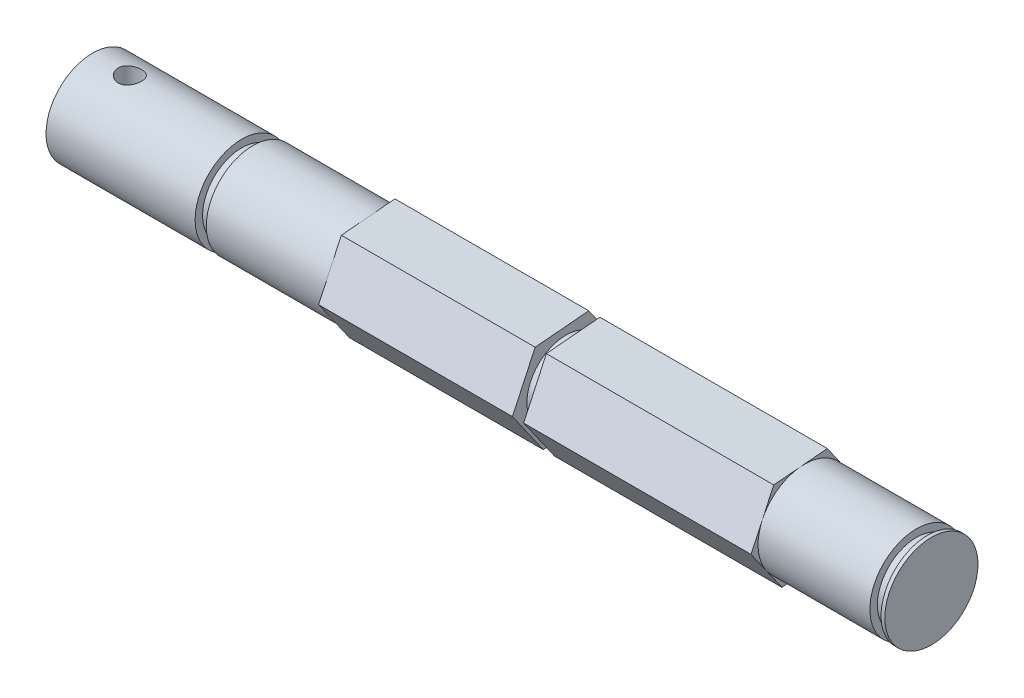
from build123d import *

# Parameters (mm, degrees)
BOSS_EXTRUDE1_DEPTH     = 38.1
SKETCH3_R               = 3.175
BOSS_EXTRUDE3_DEPTH     = 19.05
CUT_EXTRUDE1_DEPTH      = 39.418677326
CUT_EXTRUDE1_DEPTH_BACK = 39.418677326
SKETCH4_R               = 0.79375
CUT_EXTRUDE4_DEPTH      = 8.636
SKETCH6_OUTSIDE_W       = 20.904
SKETCH6_OUTSIDE_H       = 20.248
SKETCH6_OUTSIDE_R       = 2.667
CUT_EXTRUDE5_DEPTH      = 0.762
SKETCH9_OUTSIDE_W       = 20.904
SKETCH9_OUTSIDE_H       = 20.248
SKETCH9_OUTSIDE_R       = 2.667
CUT_EXTRUDE6_DEPTH      = 0.762
SKETCH10_OUTSIDE_W      = 20.904
SKETCH10_OUTSIDE_H      = 20.248
SKETCH10_OUTSIDE_R      = 2.667
CUT_EXTRUDE7_DEPTH      = 0.762


with BuildPart() as part:
    # Sketch1 → Boss-Extrude1 (new body)
    with BuildSketch(Plane(origin=(0, 0, 0), x_dir=(0, 0, -1), z_dir=(1, 0, 0))):
        Polygon((2.105028301, -3.00161443), (3.651988499, 0.32220077), (1.546960198, 3.323815199), (-2.105028301, 3.00161443), (-3.651988499, -0.32220077), (-1.546960198, -3.323815199), align=None)
    extrude(amount=BOSS_EXTRUDE1_DEPTH)

    # Sketch3 → Boss-Extrude3 (add)
    with BuildSketch(Plane.ZY):
        with Locations(Location((0, 0, 0), (0, 0, 204.958070598))):
            Circle(SKETCH3_R)
    extrude(amount=BOSS_EXTRUDE3_DEPTH)

    # Sketch4 → Cut-Extrude1 (cut, two sides: drawn at the far end of the back side and taken through both)
    with BuildSketch(Plane(origin=(0, 0, 0), x_dir=(1, 0, 0), z_dir=(0, 1, 0)).offset(-CUT_EXTRUDE1_DEPTH_BACK)):
        with Locations(Location((-16.51, 0, 0), (0, 0, 90))):
            Circle(SKETCH4_R)
    extrude(amount=CUT_EXTRUDE1_DEPTH + CUT_EXTRUDE1_DEPTH_BACK, mode=Mode.SUBTRACT)

    # Sketch5 → Cut-Extrude4 (cut)
    with BuildSketch(Plane(origin=(38.1, 0, 0), x_dir=(0, 0, -1), z_dir=(1, 0, 0))):
        with BuildLine():
            Line((-2.878508392, 1.339706848), (-2.105028301, 3.00161443))
            ThreePointArc((-2.105028301, 3.00161443), (-3.323815199, 1.546960198), (-3.651988499, -0.32220077))
            Line((-3.651988499, -0.32220077), (-2.878508392, 1.339706848))
        make_face()
        with BuildLine():
            Line((-2.878508392, 1.339706848), (-3.651988499, -0.32220077))
            Line((-3.651988499, -0.32220077), (-2.599474334, -1.823008005))
            ThreePointArc((-2.599474334, -1.823008005), (-3.162714814, -0.279034054), (-2.878508392, 1.339706848))
        make_face()
        with BuildLine():
            ThreePointArc((-3.651988499, -0.32220077), (-3.00161443, -2.105028301), (-1.546960198, -3.323815199))
            Line((-1.546960198, -3.323815199), (-2.599474334, -1.823008005))
            Line((-2.599474334, -1.823008005), (-3.651988499, -0.32220077))
        make_face()
        with BuildLine():
            Line((-2.599474334, -1.823008005), (-1.546960198, -3.323815199))
            Line((-1.546960198, -3.323815199), (0.279034067, -3.162714813))
            ThreePointArc((0.279034067, -3.162714813), (-1.339706811, -2.878508409), (-2.599474334, -1.823008005))
        make_face()
        with BuildLine():
            ThreePointArc((-1.546960198, -3.323815199), (0.32220077, -3.651988499), (2.105028301, -3.00161443))
            Line((2.105028301, -3.00161443), (0.279034067, -3.162714813))
            Line((0.279034067, -3.162714813), (-1.546960198, -3.323815199))
        make_face()
        with BuildLine():
            Line((0.279034067, -3.162714813), (2.105028301, -3.00161443))
            Line((2.105028301, -3.00161443), (2.878508392, -1.339706848))
            ThreePointArc((2.878508392, -1.339706848), (1.823007983, -2.59947435), (0.279034067, -3.162714813))
        make_face()
        with BuildLine():
            ThreePointArc((2.105028301, -3.00161443), (3.252555442, -1.69166085), (3.666174209, 0))
            ThreePointArc((3.666174209, 0), (3.662626065, 0.16125645), (3.651988499, 0.32220077))
            Line((3.651988499, 0.32220077), (2.878508392, -1.339706848))
            Line((2.878508392, -1.339706848), (2.105028301, -3.00161443))
        make_face()
        with BuildLine():
            Line((2.878508392, -1.339706848), (3.651988499, 0.32220077))
            Line((3.651988499, 0.32220077), (2.599474407, 1.823007901))
            ThreePointArc((2.599474407, 1.823007901), (3.027701789, 0.955848774), (3.175, 0))
            ThreePointArc((3.175, 0), (3.09999106, -0.686061534), (2.878508392, -1.339706848))
        make_face()
        with BuildLine():
            Line((2.599474407, 1.823007901), (3.651988499, 0.32220077))
            ThreePointArc((3.651988499, 0.32220077), (3.00161443, 2.105028301), (1.546960198, 3.323815199))
            Line((1.546960198, 3.323815199), (2.599474407, 1.823007901))
        make_face()
        with BuildLine():
            Line((2.599474407, 1.823007901), (1.546960198, 3.323815199))
            Line((1.546960198, 3.323815199), (-0.279034067, 3.162714813))
            ThreePointArc((-0.279034067, 3.162714813), (1.339706869, 2.878508382), (2.599474407, 1.823007901))
        make_face()
        with BuildLine():
            Line((-0.279034067, 3.162714813), (1.546960198, 3.323815199))
            ThreePointArc((1.546960198, 3.323815199), (-0.32220077, 3.651988499), (-2.105028301, 3.00161443))
            Line((-2.105028301, 3.00161443), (-0.279034067, 3.162714813))
        make_face()
        with BuildLine():
            Line((-0.279034067, 3.162714813), (-2.105028301, 3.00161443))
            Line((-2.105028301, 3.00161443), (-2.878508392, 1.339706848))
            ThreePointArc((-2.878508392, 1.339706848), (-1.823007983, 2.59947435), (-0.279034067, 3.162714813))
        make_face()
    extrude(amount=-CUT_EXTRUDE4_DEPTH, mode=Mode.SUBTRACT)

    # Sketch6 outside → Cut-Extrude5 (cut)
    with BuildSketch(Plane(origin=(37.084, 0, 0), x_dir=(0, 0, -1), z_dir=(1, 0, 0))):
        Rectangle(SKETCH6_OUTSIDE_W, SKETCH6_OUTSIDE_H)
        with Locations(Location((0, 0, 0), (0, 0, 180))):
            Circle(SKETCH6_OUTSIDE_R, mode=Mode.SUBTRACT)
    extrude(amount=CUT_EXTRUDE5_DEPTH, mode=Mode.SUBTRACT)

    # Sketch9 outside → Cut-Extrude6 (cut)
    with BuildSketch(Plane.ZY.offset(8.128)):
        Rectangle(SKETCH9_OUTSIDE_W, SKETCH9_OUTSIDE_H)
        Circle(SKETCH9_OUTSIDE_R, mode=Mode.SUBTRACT)
    extrude(amount=CUT_EXTRUDE6_DEPTH, mode=Mode.SUBTRACT)

    # Sketch10 outside → Cut-Extrude7 (cut)
    with BuildSketch(Plane.ZY.offset(-13.97)):
        Rectangle(SKETCH10_OUTSIDE_W, SKETCH10_OUTSIDE_H)
        with Locations(Location((0, 0, 0), (0, 0, 180))):
            Circle(SKETCH10_OUTSIDE_R, mode=Mode.SUBTRACT)
    extrude(amount=CUT_EXTRUDE7_DEPTH, mode=Mode.SUBTRACT)


solid = part.part
